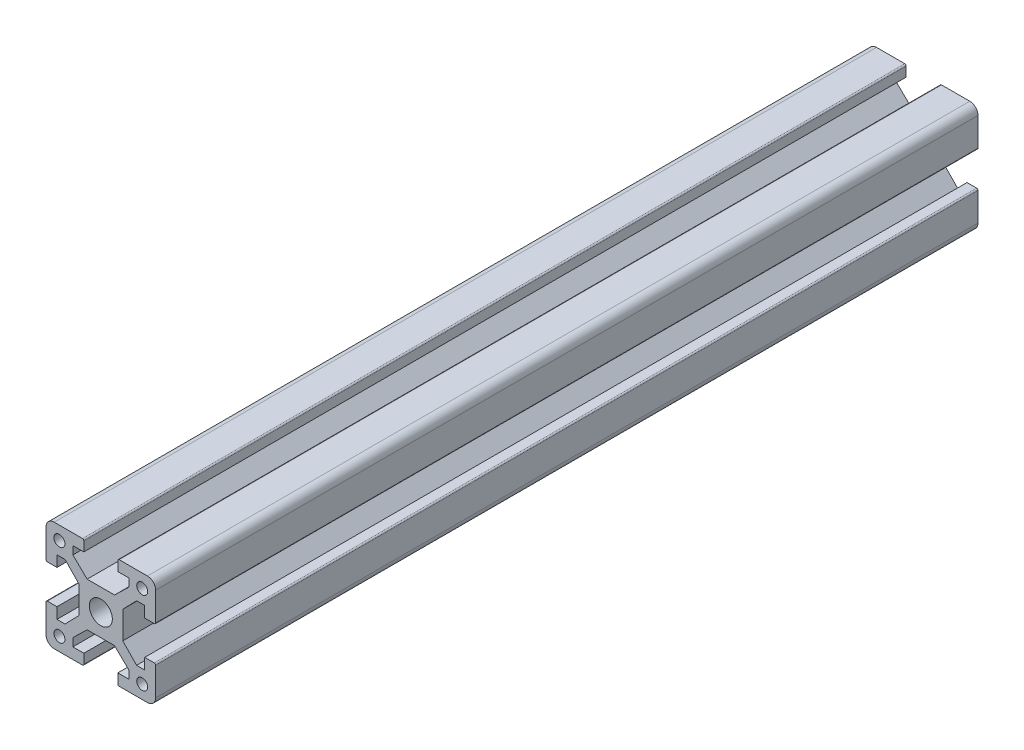
from build123d import *

# Parameters (mm, degrees)
SKETCH1_R           = 1
SKETCH1_R_2         = 2.1
BOSS_EXTRUDE2_DEPTH = 150


with BuildPart() as part:
    # Sketch1 → Boss-Extrude2 (new body)
    with BuildSketch(Plane.XY):
        with BuildLine():
            Line((-6.4, -1.5), (-6.4, -6.65))
            ThreePointArc((-6.4, -6.65), (-6.326776695, -6.826776695), (-6.15, -6.9))
            Line((-6.15, -6.9), (-4.4, -6.9))
            Line((-4.4, -6.9), (-4.4, -4.9))
            Line((-4.4, -4.9), (-2.927777778, -4.9))
            Line((-2.927777778, -4.9), (-0.4, -7.5))
            Line((-0.4, -7.5), (-0.4, -12.5))
            Line((-0.4, -12.5), (-2.927777778, -15.1))
            Line((-2.927777778, -15.1), (-4.4, -15.1))
            Line((-4.4, -15.1), (-4.4, -13.1))
            Line((-4.4, -13.1), (-6.15, -13.1))
            ThreePointArc((-6.15, -13.1), (-6.326776695, -13.173223305), (-6.4, -13.35))
            Line((-6.4, -13.35), (-6.4, -18.5))
            ThreePointArc((-6.4, -18.5), (-5.960660172, -19.560660172), (-4.9, -20))
            Line((-4.9, -20), (0.25, -20))
            ThreePointArc((0.25, -20), (0.426776695, -19.926776695), (0.5, -19.75))
            Line((0.5, -19.75), (0.5, -18))
            Line((0.5, -18), (-1.5, -18))
            Line((-1.5, -18), (-1.5, -16.527777778))
            Line((-1.5, -16.527777778), (1.1, -14))
            Line((1.1, -14), (6.1, -14))
            Line((6.1, -14), (8.7, -16.527777778))
            Line((8.7, -16.527777778), (8.7, -18))
            Line((8.7, -18), (6.7, -18))
            Line((6.7, -18), (6.7, -19.75))
            ThreePointArc((6.7, -19.75), (6.773223305, -19.926776695), (6.95, -20))
            Line((6.95, -20), (12.1, -20))
            ThreePointArc((12.1, -20), (13.160660172, -19.560660172), (13.6, -18.5))
            Line((13.6, -18.5), (13.6, -13.35))
            ThreePointArc((13.6, -13.35), (13.526776695, -13.173223305), (13.35, -13.1))
            Line((13.35, -13.1), (11.6, -13.1))
            Line((11.6, -13.1), (11.6, -15.1))
            Line((11.6, -15.1), (10.127777778, -15.1))
            Line((10.127777778, -15.1), (7.6, -12.5))
            Line((7.6, -12.5), (7.6, -7.5))
            Line((7.6, -7.5), (10.127777778, -4.9))
            Line((10.127777778, -4.9), (11.6, -4.9))
            Line((11.6, -4.9), (11.6, -6.9))
            Line((11.6, -6.9), (13.35, -6.9))
            ThreePointArc((13.35, -6.9), (13.526776695, -6.826776695), (13.6, -6.65))
            Line((13.6, -6.65), (13.6, -1.5))
            ThreePointArc((13.6, -1.5), (13.160660172, -0.439339828), (12.1, 0))
            Line((12.1, 0), (6.95, 0))
            ThreePointArc((6.95, 0), (6.773223305, -0.073223305), (6.7, -0.25))
            Line((6.7, -0.25), (6.7, -2))
            Line((6.7, -2), (8.7, -2))
            Line((8.7, -2), (8.7, -3.472222222))
            Line((8.7, -3.472222222), (6.1, -6))
            Line((6.1, -6), (1.1, -6))
            Line((1.1, -6), (-1.5, -3.472222222))
            Line((-1.5, -3.472222222), (-1.5, -2))
            Line((-1.5, -2), (0.5, -2))
            Line((0.5, -2), (0.5, -0.25))
            ThreePointArc((0.5, -0.25), (0.426776695, -0.073223305), (0.25, 0))
            Line((0.25, 0), (-4.9, 0))
            ThreePointArc((-4.9, 0), (-5.960660172, -0.439339828), (-6.4, -1.5))
        make_face()
        with Locations((-3.95, -2.45)):
            Circle(SKETCH1_R, mode=Mode.SUBTRACT)
        with Locations((11.15, -2.45)):
            Circle(SKETCH1_R, mode=Mode.SUBTRACT)
        with Locations((-3.95, -17.55)):
            Circle(SKETCH1_R, mode=Mode.SUBTRACT)
        with Locations((11.15, -17.55)):
            Circle(SKETCH1_R, mode=Mode.SUBTRACT)
        with Locations((3.6, -10)):
            Circle(SKETCH1_R_2, mode=Mode.SUBTRACT)
    extrude(amount=BOSS_EXTRUDE2_DEPTH)


solid = part.part
